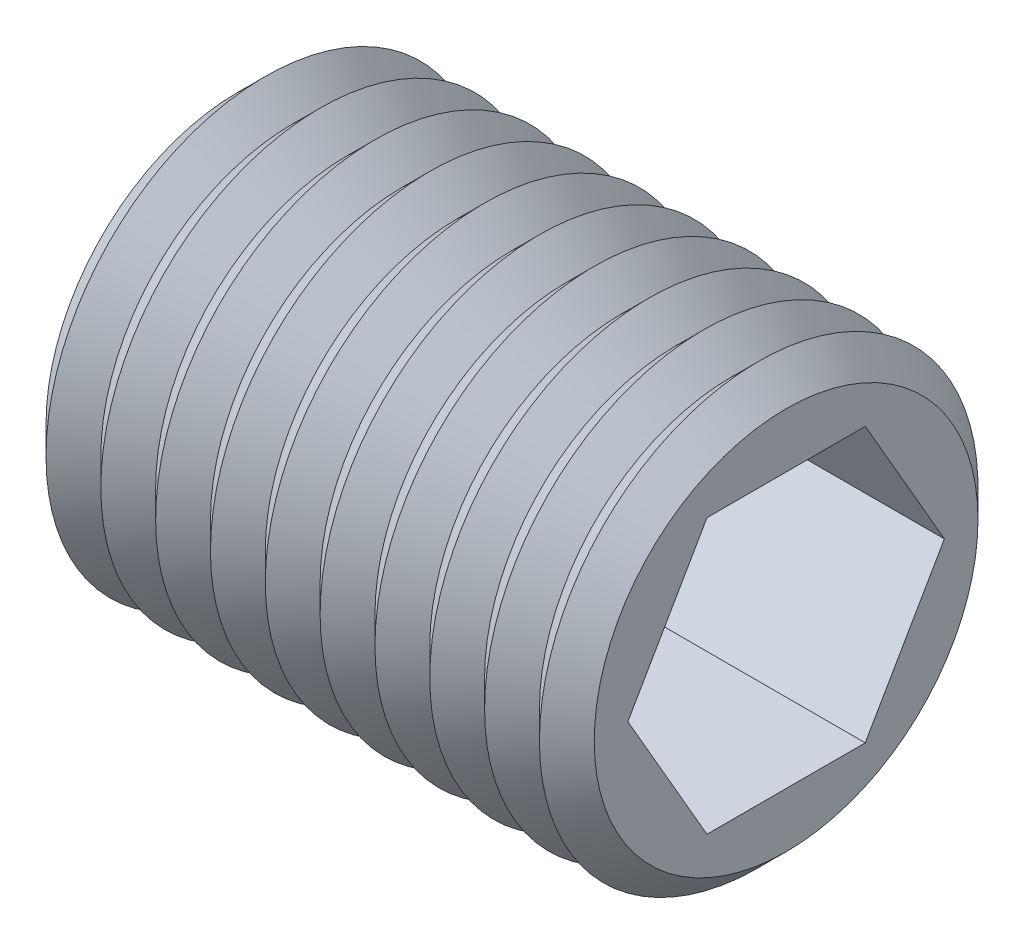
from build123d import *

# Parameters (mm, degrees)
CUT_EXTRUDE_1_DEPTH = 5


with BuildPart() as part:
    # 草图1 → 旋转1 (revolve)
    with BuildSketch(Plane.XY, mode=Mode.PRIVATE) as revolve_1_sk:
        Polygon((10, 0), (10, 3.5), (9.5, 4), (9, 3.5), (8.5, 4), (8, 3.5), (7.5, 4), (7, 3.5), (6.5, 4), (6, 3.5), (5.5, 4), (5, 3.5), (4.5, 4), (4, 3.5), (3.5, 4), (3, 3.5), (2.5, 4), (2, 3.5), (1.5, 4), (1, 3.5), (0.5, 4), (0, 3.5), (0, 0), align=None)
    revolve(revolve_1_sk.sketch.rotate(Axis((0.5, 0, 0), (1, 0, 0)), 90), axis=Axis((0.5, 0, 0), (1, 0, 0)))

    # 草图3 → 切除-拉伸1 (cut)
    with BuildSketch(Plane(origin=(10, 0, 0), x_dir=(0, 0, -1), z_dir=(1, 0, 0))):
        Polygon((2.886751346, 0), (1.443375673, 2.5), (-1.443375673, 2.5), (-2.886751346, 0), (-1.443375673, -2.5), (1.443375673, -2.5), align=None)
    extrude(amount=-CUT_EXTRUDE_1_DEPTH, mode=Mode.SUBTRACT)


solid = part.part
